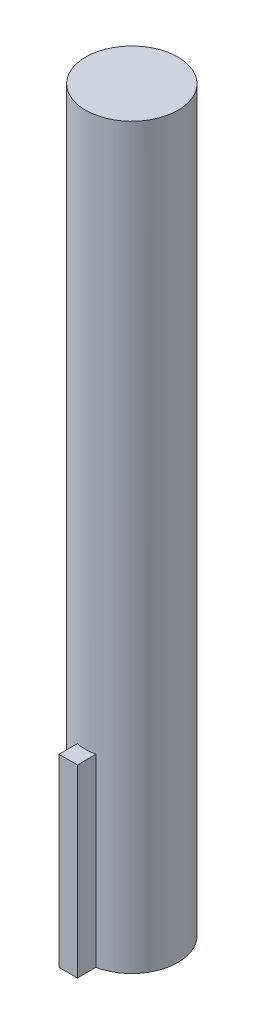
from build123d import *

# Parameters (mm, degrees)
BOSS_EXTRUDE1_DEPTH = 10
SKETCH2_R           = 2.5
BOSS_EXTRUDE2_DEPTH = 30


with BuildPart() as part:
    # Sketch1 → Boss-Extrude1 (new body)
    with BuildSketch(Plane(origin=(0, 0, 0), x_dir=(1, 0, 0), z_dir=(0, 1, 0))):
        with BuildLine():
            Line((-0.5, -2.449489743), (-0.5, -3.449489743))
            Line((-0.5, -3.449489743), (0.5, -3.449489743))
            Line((0.5, -3.449489743), (0.5, -2.449489743))
            ThreePointArc((0.5, -2.449489743), (0, 2.5), (-0.5, -2.449489743))
        make_face()
    extrude(amount=BOSS_EXTRUDE1_DEPTH)

    # Sketch2 → Boss-Extrude2 (add)
    with BuildSketch(Plane(origin=(0, 10, 0), x_dir=(1, 0, 0), z_dir=(0, 1, 0))):
        with Locations(Location((0, 0, 0), (0, 0, 258.463040967))):
            Circle(SKETCH2_R)
    extrude(amount=BOSS_EXTRUDE2_DEPTH)


solid = part.part
